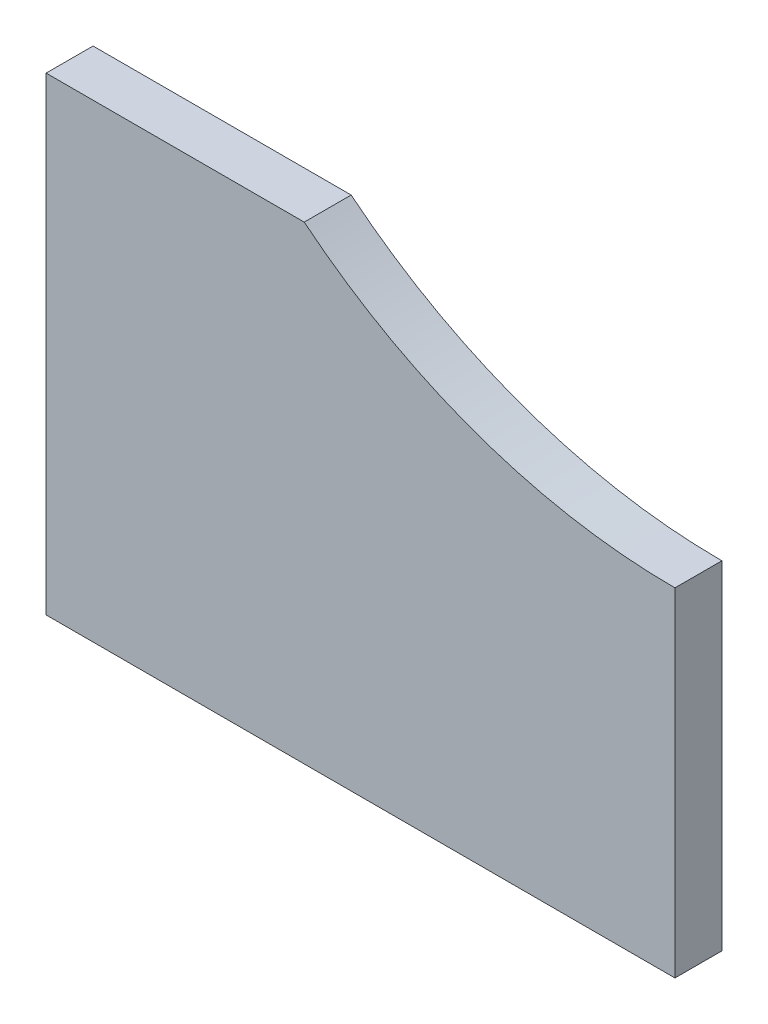
from build123d import *

# Parameters (mm, degrees)
BOSS_EXTRUDE2_DEPTH = 6.35


with BuildPart() as part:
    # Sketch1 → Boss-Extrude2 (new, symmetric)
    with BuildSketch(Plane.XY):
        with BuildLine():
            Line((-85.09, 63.5), (-85.09, -63.5))
            Line((-85.09, -63.5), (85.09, -63.5))
            Line((85.09, -63.5), (85.09, 27.94))
            ThreePointArc((85.09, 27.94), (31.8673016, 37.092922371), (-15.24, 63.5))
            Line((-15.24, 63.5), (-85.09, 63.5))
        make_face()
    extrude(amount=BOSS_EXTRUDE2_DEPTH, both=True)


solid = part.part
